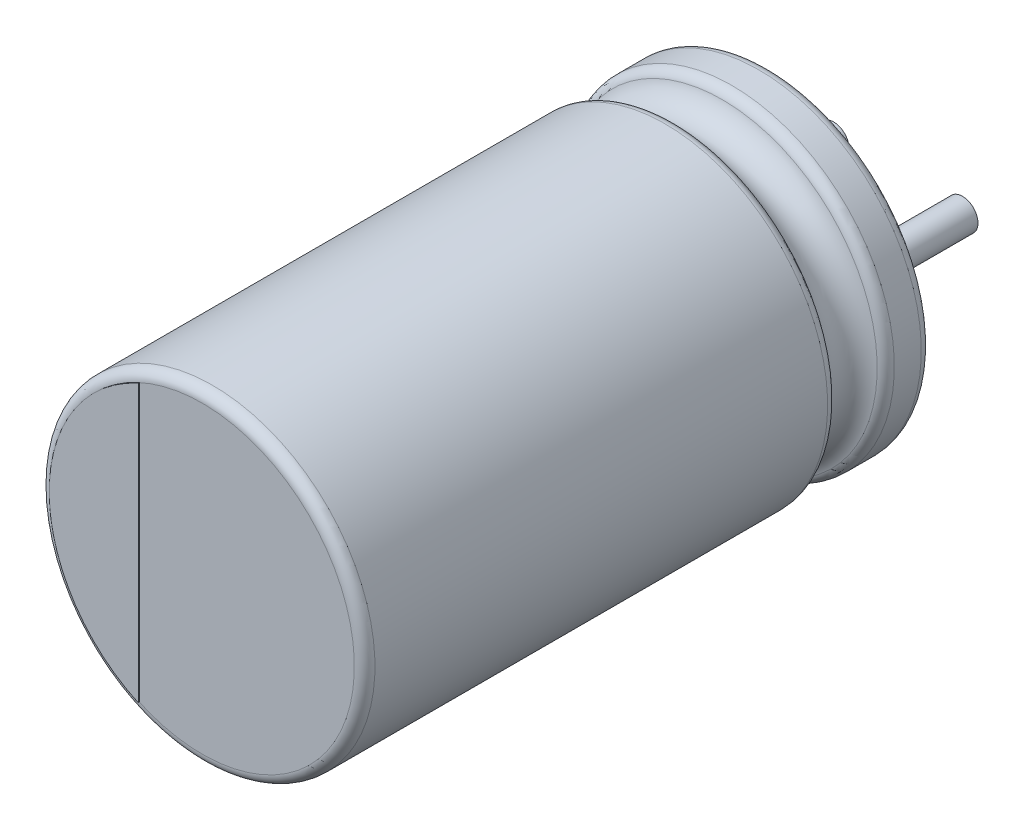
from build123d import *

# Parameters (mm, degrees)
SKETCH_2_R        = 0.3
EXTRUDE_1_DEPTH   = 2.5
EXTRUDE_1_2_DEPTH = 2.5
EXTRUDE_2_DEPTH   = 0.02


with BuildPart() as part:
    # Эскиз1 → Повернуть1 (revolve)
    with BuildSketch(Plane(origin=(0, 0, 0), x_dir=(1, 0, 0), z_dir=(0, 1, 0))):
        with BuildLine():
            Line((-3.15, -2.017273049), (-3.15, -10.8))
            ThreePointArc((-3.15, -10.8), (-3.091421356, -10.941421356), (-2.95, -11))
            Line((-2.95, -11), (0, -11))
            Line((0, -11), (0, 0))
            Line((0, 0), (-2.95, 0))
            ThreePointArc((-2.95, 0), (-3.091421356, -0.058578644), (-3.15, -0.2))
            Line((-3.15, -0.2), (-3.15, -0.723485332))
            ThreePointArc((-3.15, -0.723485332), (-3.11095807, -0.842197167), (-3.009075002, -0.91456161))
            ThreePointArc((-3.009075002, -0.91456161), (-2.672894643, -1.370379191), (-3.009075002, -1.826196771))
            ThreePointArc((-3.009075002, -1.826196771), (-3.11095807, -1.898561214), (-3.15, -2.017273049))
        make_face()
    revolve(axis=Axis((0, 0, 0), (0, 0, 1)))


with BuildPart() as body_2:
    # Эскиз2 → Бобышка-Вытянуть1 (new body)
    with BuildSketch(Plane.XY):
        with Locations((1.25, 0)):
            Circle(SKETCH_2_R)
    extrude(amount=-EXTRUDE_1_DEPTH)


with BuildPart() as body_3:
    # Эскиз2 → Extrude 1 2 (new body)
    with BuildSketch(Plane.XY):
        with Locations(Location((-1.25, 0, 0), (0, 0, 180))):
            Circle(SKETCH_2_R)
    extrude(amount=-EXTRUDE_1_2_DEPTH)


with BuildPart() as body_4:
    # Эскиз3 → Бобышка-Вытянуть2 (new body)
    with BuildSketch(Plane.XY.offset(11)):
        with BuildLine():
            Line((-1.222424003, 2.684805311), (-1.222424003, -2.684805311))
            ThreePointArc((-1.222424003, -2.684805311), (-2.95, 0), (-1.222424003, 2.684805311))
        make_face()
    extrude(amount=EXTRUDE_2_DEPTH)


solid = Compound([part.part, body_2.part, body_3.part, body_4.part])
